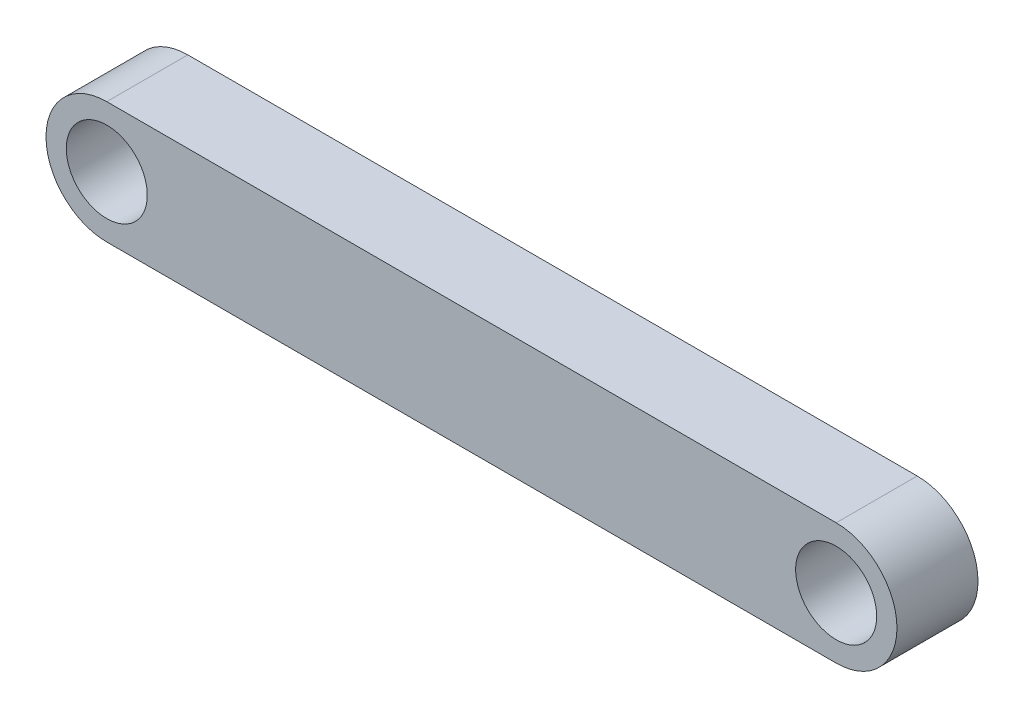
from build123d import *

# Parameters (mm, degrees)
SKETCH1_R           = 2
BOSS_EXTRUDE1_DEPTH = 4


with BuildPart() as part:
    # Sketch1 → Boss-Extrude1 (new body)
    with BuildSketch(Plane.XY):
        with BuildLine():
            Line((-36, 3), (0, 3))
            ThreePointArc((0, 3), (3, 0), (0, -3))
            Line((0, -3), (-36, -3))
            ThreePointArc((-36, -3), (-39, 0), (-36, 3))
        make_face()
        Circle(SKETCH1_R, mode=Mode.SUBTRACT)
        with Locations(Location((-36, 0, 0), (0, 0, 180))):
            Circle(SKETCH1_R, mode=Mode.SUBTRACT)
    extrude(amount=BOSS_EXTRUDE1_DEPTH)


solid = part.part
